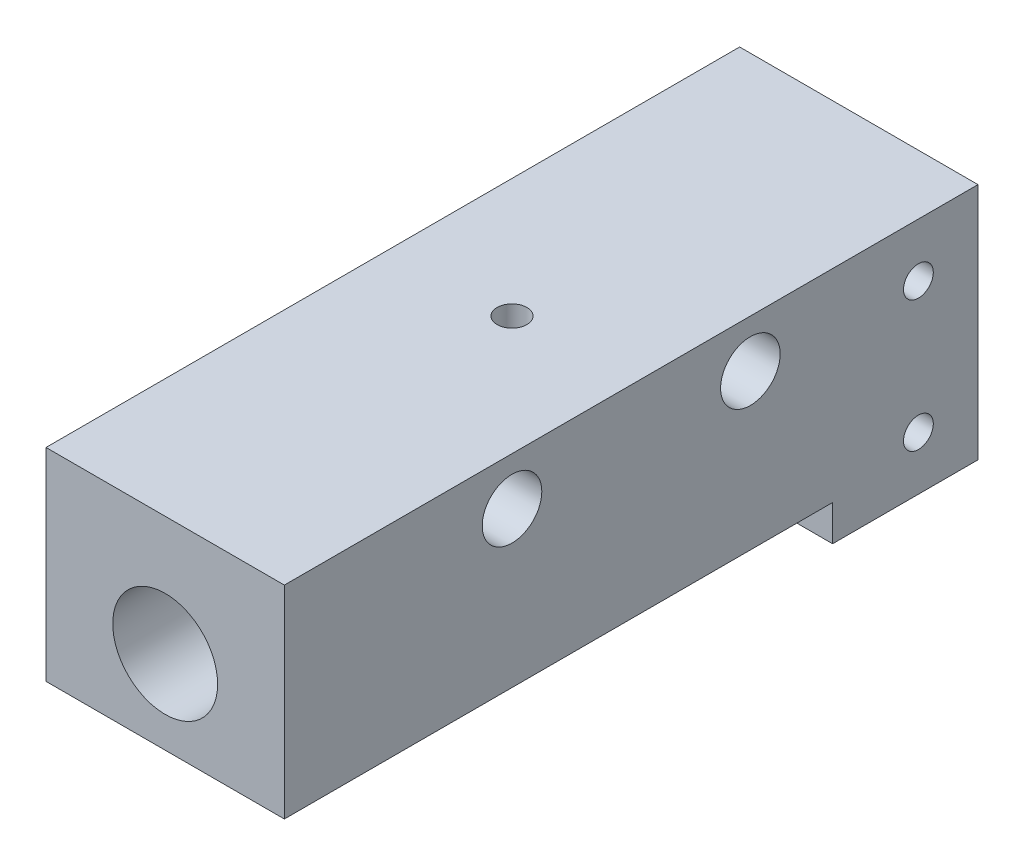
from build123d import *

# Parameters (mm, degrees)
SCHIZZO1_W                    = 20
SCHIZZO1_H                    = 20
ESTRUSIONE_ESTRUSIONE1_DEPTH  = 58.2
SCHIZZO2_R                    = 3
TAGLIO_ESTRUSIONE1_DEPTH      = 60.893572276
FORO_FILETTATO_G1_8_1_D       = 8.8
FORO_FILETTATO_G1_8_1_DEPTH   = 10
FORO_FILETTATO_G1_8_1_TIP     = 2.643786724
TAGLIO_ESTRUSIONE5_DEPTH      = 63.347734522
TAGLIO_ESTRUSIONE5_DEPTH_BACK = 63.347734522
FORO_FILETTATO_M3_1_D         = 2.5
FORO_FILETTATO_M3_1_DEPTH     = 5
FORO_FILETTATO_M3_1_TIP       = 0.751075774
FORO_FILETTATO_M3_2_D         = 2.5
M4_CLEARANCE_HOLE1_D          = 5


with BuildPart() as part:
    # Schizzo1 → Estrusione-Estrusione1 (new body)
    with BuildSketch(Plane.XY):
        Rectangle(SCHIZZO1_W, SCHIZZO1_H)
    extrude(amount=-ESTRUSIONE_ESTRUSIONE1_DEPTH)

    # Schizzo2 → Taglio-Estrusione1 (cut, through all)
    with BuildSketch(Plane(origin=(0, 0, -58.2), x_dir=(-1, 0, 0), z_dir=(0, 0, -1))):
        Circle(SCHIZZO2_R)
    extrude(amount=-TAGLIO_ESTRUSIONE1_DEPTH, mode=Mode.SUBTRACT)

    # Foro filettato G1/8-1
    with Locations(Plane.XY):
        with Locations((0, 0)):
            Hole(FORO_FILETTATO_G1_8_1_D / 2, depth=FORO_FILETTATO_G1_8_1_DEPTH)
            with Locations((0, 0, -(FORO_FILETTATO_G1_8_1_DEPTH + FORO_FILETTATO_G1_8_1_TIP / 2))):  # 118° drill point
                Cone(0, FORO_FILETTATO_G1_8_1_D / 2, FORO_FILETTATO_G1_8_1_TIP, mode=Mode.SUBTRACT)

    # Schizzo10 → Taglio-Estrusione5 (cut, two sides: drawn at the far end of the back side and taken through both)
    with BuildSketch(Plane(origin=(10, 0, 0), x_dir=(0, 0, -1), z_dir=(1, 0, 0)).offset(-TAGLIO_ESTRUSIONE5_DEPTH_BACK)):
        Polygon((-131.2640095, -7), (0, -7), (46, -7), (46, -10), (46, -141.2640095), (-112.509379382, -350.53832089), (-289.773388882, -216.27431139), align=None)
    extrude(amount=TAGLIO_ESTRUSIONE5_DEPTH + TAGLIO_ESTRUSIONE5_DEPTH_BACK, mode=Mode.SUBTRACT)

    # Foro filettato M3-1
    with Locations(Plane(origin=(0, 10, -29.1), x_dir=(1, 0, 0), z_dir=(0, 1, 0))):
        with Locations((0, 0)):
            Hole(FORO_FILETTATO_M3_1_D / 2, depth=FORO_FILETTATO_M3_1_DEPTH)
            with Locations((0, 0, -(FORO_FILETTATO_M3_1_DEPTH + FORO_FILETTATO_M3_1_TIP / 2))):  # 118° drill point
                Cone(0, FORO_FILETTATO_M3_1_D / 2, FORO_FILETTATO_M3_1_TIP, mode=Mode.SUBTRACT)

    # Schizzo14 → Foro Ø16.0 (16)-1 (revolve, cut)
    with BuildSketch(Plane(origin=(0, 0, -58.2), x_dir=(0, 1, 0), z_dir=(1, 0, 0))):
        Polygon((0, 0), (0, 16.806884952), (8, 12), (8, 0), align=None)
    revolve(axis=Axis((0, 0, -64.55), (0, 0, 1)), mode=Mode.SUBTRACT)

    # Foro filettato M3-2 (through all)
    with Locations(Plane(origin=(10, 5.5, -53.2), x_dir=(0, 0, 1), z_dir=(1, 0, 0))):
        with Locations((0, 0), (0, 11)):
            Hole(FORO_FILETTATO_M3_2_D / 2)

    # M4 Clearance Hole1 (through all)
    with Locations(Plane(origin=(10, 6, -19.1), x_dir=(0, 0, 1), z_dir=(1, 0, 0))):
        with Locations((0, 0), (-20, 0)):
            Hole(M4_CLEARANCE_HOLE1_D / 2)


solid = part.part
